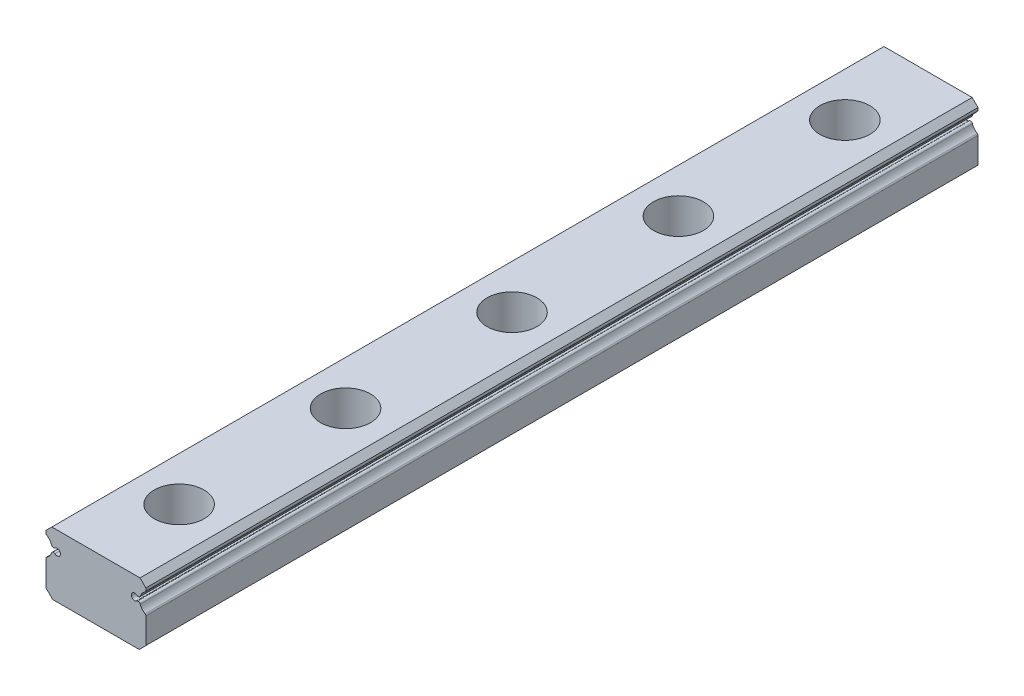
from build123d import *

# Parameters (mm, degrees)
SKETCH4_W                                           = 12
SKETCH4_H                                           = 7.5
BOSS_EXTRUDE1_DEPTH                                 = 100
CUT_EXTRUDE1_DEPTH                                  = 101.460191121
FILLET1_R                                           = 0.2
CHAMFER1_SIZE                                       = 0.7
CHAMFER2_SIZE                                       = 0.8
CBORE_FOR_M3_HEX_SOCKET_HEAD_CAP_SCREW1_D           = 3.5
CBORE_FOR_M3_HEX_SOCKET_HEAD_CAP_SCREW1_CBORE_D     = 6
CBORE_FOR_M3_HEX_SOCKET_HEAD_CAP_SCREW1_CBORE_DEPTH = 4.4
LPATTERN1_COUNT                                     = 5
LPATTERN1_PITCH                                     = 20


with BuildPart() as part:
    # Sketch4 → Boss-Extrude1 (new body)
    with BuildSketch(Plane.XY):
        with Locations((0, -3.75)):
            Rectangle(SKETCH4_W, SKETCH4_H)
    extrude(amount=BOSS_EXTRUDE1_DEPTH)

    # Sketch5 → Cut-Extrude1 (cut, through all)
    with BuildSketch(Plane.XY):
        with BuildLine():
            ThreePointArc((-5.329252402, -1.887480513), (-7.9134, -2.3), (-5.329252402, -2.712519487))
            ThreePointArc((-5.329252402, -2.712519487), (-5.158134449, -2.549348252), (-4.927570698, -2.601755909))
            ThreePointArc((-4.927570698, -2.601755909), (-4.265, -2.3), (-4.927570698, -1.998244091))
            ThreePointArc((-4.927570698, -1.998244091), (-5.158134449, -2.050651748), (-5.329252402, -1.887480513))
        make_face()
    cut_extrude1 = extrude(amount=CUT_EXTRUDE1_DEPTH, mode=Mode.SUBTRACT)

    # Mirror3: Cut-Extrude1 across plane
    add(cut_extrude1.mirror(Plane(origin=(0, 0, 0), x_dir=(0, 0, 1), z_dir=(1, 0, 0))), mode=Mode.SUBTRACT)

    # Fillet1
    fillet1_edges = [part.edges().sort_by_distance(p)[0] for p in [
        (-6, -3.487185933, 50),
        (-6, -1.112814067, 50),
        (6, -1.112814067, 50),
        (6, -3.487185933, 50),
    ]]
    fillet(fillet1_edges, radius=FILLET1_R)

    # Chamfer1
    chamfer1_edges = [part.edges().sort_by_distance(p)[0] for p in [
        (-6, 0, 50),
        (6, 0, 50),
    ]]
    chamfer(chamfer1_edges, length=CHAMFER1_SIZE)

    # Chamfer2
    chamfer2_edges = [part.edges().sort_by_distance(p)[0] for p in [
        (6, -7.5, 50),
        (-6, -7.5, 50),
    ]]
    chamfer(chamfer2_edges, length=CHAMFER2_SIZE)

    # CBORE for M3 Hex Socket Head Cap Screw1 (through all)
    with Locations(Plane(origin=(0, 0, 0), x_dir=(1, 0, 0), z_dir=(0, 1, 0))):
        with Locations((0, -10)):
            cbore_for_m3_hex_socket_head_cap_screw1 = CounterBoreHole(CBORE_FOR_M3_HEX_SOCKET_HEAD_CAP_SCREW1_D / 2, CBORE_FOR_M3_HEX_SOCKET_HEAD_CAP_SCREW1_CBORE_D / 2, CBORE_FOR_M3_HEX_SOCKET_HEAD_CAP_SCREW1_CBORE_DEPTH)

    # LPattern1: CBORE for M3 Hex Socket Head Cap Screw1 ×5
    with Locations(*[(0, 0, i * LPATTERN1_PITCH) for i in range(1, LPATTERN1_COUNT)]):
        add(cbore_for_m3_hex_socket_head_cap_screw1, mode=Mode.SUBTRACT)


solid = part.part
